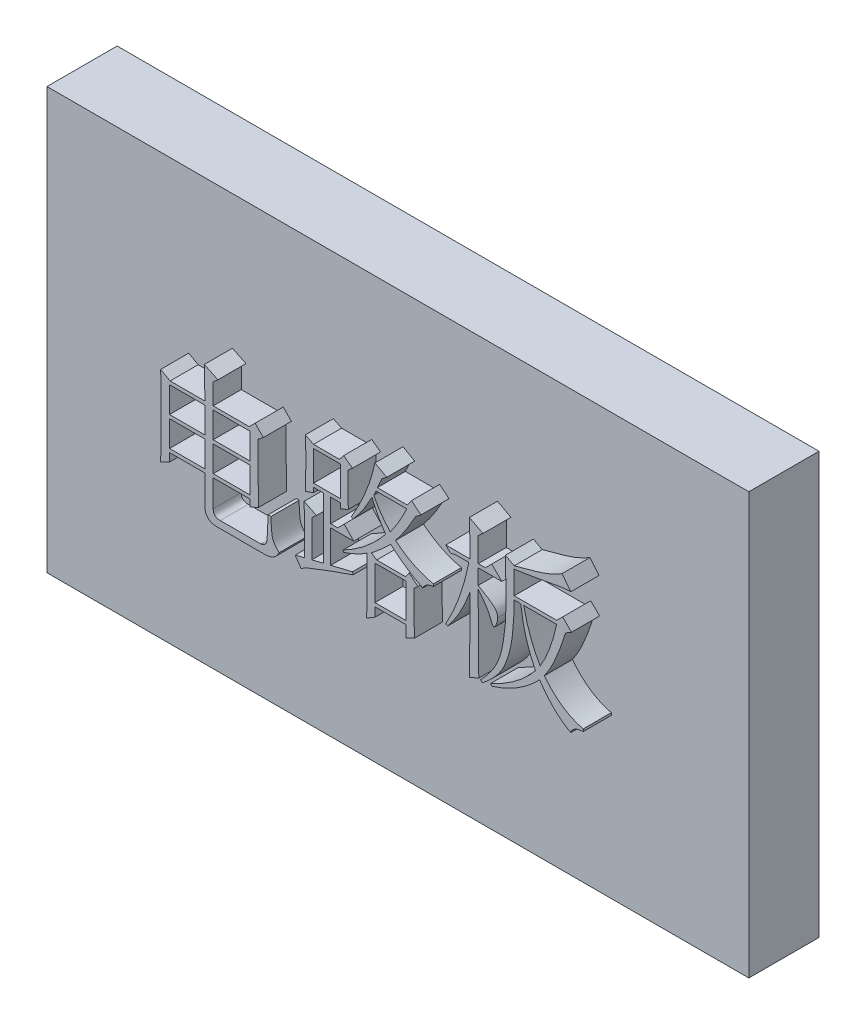
from build123d import *

# Parameters (mm, degrees)
SKETCH_1_W      = 25
SKETCH_1_H      = 15
EXTRUDE_1_DEPTH = 2.5
SKETCH_2_W      = 1.261471265
SKETCH_2_H      = 0.920406812
SKETCH_2_W_2    = 1.303520307
SKETCH_2_W_3    = 1.114299617
SKETCH_2_H_2    = 1.219422222
SKETCH_2_W_4    = 0.96712797
SKETCH_2_H_3    = 1.069914517
EXTRUDE_3_DEPTH = 1


with BuildPart() as part:
    # 草图1 → 凸台-拉伸1 (new body)
    with BuildSketch(Plane.XY):
        Rectangle(SKETCH_1_W, SKETCH_1_H)
    extrude(amount=EXTRUDE_1_DEPTH)

    # 草图2 → 凸台-拉伸3 (add)
    # profile 1 of 5: a face of its own
    with BuildSketch(Plane.XY.offset(2.5)):
        with BuildLine():
            add(Edge.make_bspline(
                [(-5.873960112, 1.610145071), (-5.874293191, 1.71007808), (-5.874944667, 1.905538999), (-5.879030599, 2.192102448), (-5.884704815, 2.465460886), (-5.891614746, 2.643209641), (-5.894984633, 2.72989549)],
                knots=[0, 0, 0, 0, 1.070688816, 2.094181113, 3.070555925, 4, 4, 4, 4], degree=3))
            Line((-5.894984633, 2.72989549), (-5.411420649, 2.497847072))
            Line((-5.411420649, 2.497847072), (-5.579616817, 2.349896738))
            Line((-5.579616817, 2.349896738), (-5.579616817, 1.610145071))
            Line((-5.579616817, 1.610145071), (-4.297121031, 1.610145071))
            Line((-4.297121031, 1.610145071), (-4.08687582, 1.820390281))
            Line((-4.08687582, 1.820390281), (-3.792532525, 1.526046986))
            Line((-3.792532525, 1.526046986), (-3.981753215, 1.379654025))
            add(Edge.make_bspline(
                [(-3.981753215, 1.379654025), (-3.981731731, 1.311389266), (-3.981689824, 1.178234053), (-3.981987073, 0.983561398), (-3.980943247, 0.7987543), (-3.980226075, 0.623809432), (-3.979459302, 0.458727802), (-3.978593576, 0.303510478), (-3.978121896, 0.157891394), (-3.976314109, 0.021884914), (-3.974814658, -0.104262642), (-3.97327917, -0.220287543), (-3.971628187, -0.326446437), (-3.970390741, -0.423016251), (-3.967854092, -0.509701436), (-3.96555129, -0.586532735), (-3.963260937, -0.653502519), (-3.961529551, -0.695025815), (-3.960728694, -0.714232538)],
                knots=[0, 0, 0, 0, 1.564731616, 3.052119083, 4.462174954, 5.800836896, 7.0621555, 8.246130873, 9.358712606, 10.399951826, 11.363852354, 12.25041514, 13.059641411, 13.79748155, 14.464070136, 15.047399153, 15.559371661, 16, 16, 16, 16], degree=3))
            Line((-3.960728694, -0.714232538), (-4.27609651, -0.861404186))
            Line((-4.27609651, -0.861404186), (-4.27609651, -0.609109933))
            Line((-4.27609651, -0.609109933), (-5.579616817, -0.609109933))
            Line((-5.579616817, -0.609109933), (-5.579616817, -1.567672357))
            add(Edge.make_bspline(
                [(-5.579616817, -1.567672357), (-5.578941822, -1.586152535), (-5.577671101, -1.620942644), (-5.566406628, -1.669817831), (-5.545200229, -1.710491068), (-5.517842815, -1.745437686), (-5.480787622, -1.771230159), (-5.436393384, -1.789323043), (-5.384401313, -1.799982446), (-5.347101545, -1.801338014), (-5.327322564, -1.802056833)],
                knots=[0, 0, 0, 0, 1.124103962, 2.116197056, 3.020287974, 3.895928428, 4.79003215, 5.731558757, 6.79711165, 8, 8, 8, 8], degree=3))
            Line((-5.327322564, -1.802056833), (-3.876630609, -1.802056833))
            add(Edge.make_bspline(
                [(-3.876630609, -1.802056833), (-3.861707878, -1.800003426), (-3.832839016, -1.796030996), (-3.793121644, -1.781467096), (-3.757682669, -1.76303101), (-3.728433092, -1.737460701), (-3.704798967, -1.706279624), (-3.685727652, -1.669822118), (-3.672828869, -1.627563441), (-3.665481071, -1.578770717), (-3.66054034, -1.521246414), (-3.654742189, -1.451974575), (-3.650791656, -1.36961154), (-3.644901007, -1.274652334), (-3.639707259, -1.167177927), (-3.633919113, -1.047023121), (-3.629815425, -0.913824864), (-3.626219519, -0.820650409), (-3.624336356, -0.7718553)],
                knots=[0, 0, 0, 0, 0.629422311, 1.217652751, 1.762775589, 2.294829829, 2.829987746, 3.394303386, 4.0100451, 4.671629752, 5.458421737, 6.429409418, 7.584151651, 8.913252979, 10.416123777, 12.092816459, 13.95382277, 16, 16, 16, 16], degree=3))
            Line((-3.624336356, -0.7718553), (-3.519213751, -0.7718553))
            add(Edge.make_bspline(
                [(-3.519213751, -0.7718553), (-3.519253568, -0.813910538), (-3.519329535, -0.894148352), (-3.514760154, -1.008863305), (-3.51025316, -1.112299591), (-3.501182999, -1.204411889), (-3.491628773, -1.28556703), (-3.479274074, -1.35577969), (-3.465179292, -1.415114465), (-3.442242632, -1.478436078), (-3.406765852, -1.546606592), (-3.355084501, -1.618889323), (-3.295267482, -1.684650681), (-3.248562901, -1.720697385), (-3.224870456, -1.738983269)],
                knots=[0, 0, 0, 0, 1.432623561, 2.73332378, 3.91109551, 4.959115756, 5.885964426, 6.694330385, 7.387096859, 7.960541899, 8.984902095, 9.993374407, 10.982072752, 12, 12, 12, 12], degree=3))
            add(Edge.make_bspline(
                [(-3.224870456, -1.738983269), (-3.239033072, -1.765319229), (-3.266385839, -1.816182809), (-3.316257265, -1.883703331), (-3.372191551, -1.939173319), (-3.434465615, -1.983581626), (-3.506808709, -2.016492311), (-3.59086943, -2.037890584), (-3.687445656, -2.052199201), (-3.75613395, -2.053605745), (-3.792532525, -2.054351086)],
                knots=[0, 0, 0, 0, 1.033786579, 1.996588944, 2.892065822, 3.749251075, 4.629327101, 5.624996779, 6.741463396, 8, 8, 8, 8], degree=3))
            Line((-3.792532525, -2.054351086), (-5.43244517, -2.054351086))
            add(Edge.make_bspline(
                [(-5.43244517, -2.054351086), (-5.467065469, -2.053044287), (-5.532249894, -2.050583797), (-5.623732976, -2.031460367), (-5.701774586, -1.99831545), (-5.765298874, -1.950063462), (-5.815267176, -1.888869649), (-5.850493015, -1.81387099), (-5.870309003, -1.725455141), (-5.872696082, -1.662516481), (-5.873960112, -1.629188548)],
                knots=[0, 0, 0, 0, 1.182522994, 2.2264996, 3.175847754, 4.055853476, 4.925921917, 5.850408872, 6.861726179, 8, 8, 8, 8], degree=3))
            Line((-5.873960112, -1.629188548), (-5.873960112, -0.609109933))
            Line((-5.873960112, -0.609109933), (-7.135431377, -0.609109933))
            Line((-7.135431377, -0.609109933), (-7.135431377, -0.903453228))
            Line((-7.135431377, -0.903453228), (-7.450799194, -1.050624875))
            add(Edge.make_bspline(
                [(-7.450799194, -1.050624875), (-7.444911768, -0.809244923), (-7.432986217, -0.320306431), (-7.428785836, 0.291826232), (-7.430878263, 0.780335001), (-7.434820694, 1.133864599), (-7.440536944, 1.471845939), (-7.447432366, 1.691913411), (-7.450799194, 1.79936576)],
                knots=[0, 0, 0, 0, 1.524726016, 3.088480342, 3.86542604, 4.609627723, 5.321122896, 6, 6, 6, 6], degree=3))
            Line((-7.450799194, 1.79936576), (-7.114406856, 1.610145071))
            Line((-7.114406856, 1.610145071), (-5.873960112, 1.610145071))
        make_face()
        with Locations((-6.504695745, 1.023794538)):
            Rectangle(SKETCH_2_W, SKETCH_2_H, mode=Mode.SUBTRACT)
        with Locations((-4.927856664, 1.023794538)):
            Rectangle(SKETCH_2_W_2, SKETCH_2_H, mode=Mode.SUBTRACT)
        with Locations((-6.504695745, -0.0227594)):
            Rectangle(SKETCH_2_W, SKETCH_2_H, mode=Mode.SUBTRACT)
        with Locations((-4.927856664, -0.0227594)):
            Rectangle(SKETCH_2_W_2, SKETCH_2_H, mode=Mode.SUBTRACT)
    # profile 2 of 5: a face of its own
    with BuildSketch(Plane.XY.offset(2.5)):
        with BuildLine():
            add(Edge.make_bspline(
                [(1.568720351, -0.443249822), (1.568570125, -0.516965985), (1.568275487, -0.661545011), (1.570391334, -0.874122292), (1.571620607, -1.078142476), (1.573908687, -1.273596714), (1.577382192, -1.460470938), (1.579864933, -1.639075426), (1.585026248, -1.809066965), (1.588201791, -1.919638222), (1.589744872, -1.973367745)],
                knots=[0, 0, 0, 0, 1.156075091, 2.267402447, 3.333953499, 4.355768899, 5.332869445, 6.265198951, 7.157013905, 8, 8, 8, 8], degree=3))
            Line((1.589744872, -1.973367745), (1.295401577, -2.119760707))
            Line((1.295401577, -2.119760707), (1.295401577, -1.705499773))
            Line((1.295401577, -1.705499773), (0.18110196, -1.705499773))
            Line((0.18110196, -1.705499773), (0.18110196, -2.030211821))
            Line((0.18110196, -2.030211821), (-0.113241336, -2.203858791))
            add(Edge.make_bspline(
                [(-0.113241336, -2.203858791), (-0.111677547, -2.144419465), (-0.108365712, -2.018537238), (-0.103258519, -1.819209415), (-0.100817069, -1.598559023), (-0.097352055, -1.357174421), (-0.095089802, -1.09475348), (-0.093860257, -0.811568131), (-0.091759637, -0.507104577), (-0.092061069, -0.297116823), (-0.092216815, -0.188619511)],
                knots=[0, 0, 0, 0, 0.708063395, 1.499555993, 2.37437348, 3.335728837, 4.374319062, 5.49943061, 6.707995802, 8, 8, 8, 8], degree=3))
            add(Edge.make_bspline(
                [(-0.092216815, -0.188619511), (-0.118014563, -0.206252865), (-0.171121922, -0.242552966), (-0.256602197, -0.294060425), (-0.350016826, -0.344452417), (-0.451549246, -0.39407211), (-0.560457039, -0.444007023), (-0.677578425, -0.493085489), (-0.802579661, -0.54111291), (-0.88899861, -0.571675475), (-0.933197658, -0.587306726)],
                knots=[0, 0, 0, 0, 0.803181656, 1.65343328, 2.564064877, 3.530923237, 4.558069038, 5.643652808, 6.794844159, 8, 8, 8, 8], degree=3))
            Line((-0.933197658, -0.587306726), (-0.954222179, -0.524233162))
            add(Edge.make_bspline(
                [(-0.954222179, -0.524233162), (-0.882913931, -0.486350833), (-0.740469037, -0.410677337), (-0.534894098, -0.282969719), (-0.33562049, -0.144624242), (-0.142646635, 0.004398734), (0.042958553, 0.16587986), (0.223159589, 0.336977757), (0.396368227, 0.519928846), (0.504907357, 0.649455575), (0.559543339, 0.71465621)],
                knots=[0, 0, 0, 0, 0.983426103, 1.964485598, 2.945998498, 3.937716184, 4.933016487, 5.941692797, 6.963897756, 8, 8, 8, 8], degree=3))
            add(Edge.make_bspline(
                [(0.559543339, 0.71465621), (0.51463944, 0.782697973), (0.423298193, 0.921105096), (0.298955673, 1.140925825), (0.181360808, 1.373356091), (0.111487205, 1.535006789), (0.075979354, 1.617153244)],
                knots=[0, 0, 0, 0, 0.953642408, 1.939851275, 2.953088865, 4, 4, 4, 4], degree=3))
            add(Edge.make_bspline(
                [(0.075979354, 1.617153244), (0.049799229, 1.56741511), (-0.001830505, 1.469326707), (-0.08322584, 1.327149053), (-0.164220887, 1.190697557), (-0.248388217, 1.061891082), (-0.332584268, 0.93880802), (-0.41951029, 0.822989679), (-0.5061018, 0.712617441), (-0.566894148, 0.643527416), (-0.596805321, 0.609533604)],
                knots=[0, 0, 0, 0, 1.110413406, 2.189842468, 3.236429234, 4.244932439, 5.229299372, 6.182130003, 7.105567974, 8, 8, 8, 8], degree=3))
            Line((-0.596805321, 0.609533604), (-0.659878884, 0.651582646))
            add(Edge.make_bspline(
                [(-0.659878884, 0.651582646), (-0.610412244, 0.735561918), (-0.512205584, 0.902286882), (-0.377588063, 1.157517518), (-0.254563144, 1.414458777), (-0.142696128, 1.673185385), (-0.043836509, 1.934451624), (0.043237162, 2.197667995), (0.11953147, 2.462506476), (0.160614833, 2.640923769), (0.18110196, 2.72989549)],
                knots=[0, 0, 0, 0, 1.038482929, 2.061711474, 3.0736857, 4.073525645, 5.064454001, 6.049318829, 7.027249784, 8, 8, 8, 8], degree=3))
            Line((0.18110196, 2.72989549), (0.601592381, 2.4962897))
            Line((0.601592381, 2.4962897), (0.433396213, 2.369363887))
            add(Edge.make_bspline(
                [(0.433396213, 2.369363887), (0.429509715, 2.361314085), (0.420727394, 2.343123939), (0.406014852, 2.313100796), (0.38872493, 2.277094099), (0.369439937, 2.23483825), (0.346857234, 2.186940861), (0.321788019, 2.133020297), (0.294696362, 2.072868347), (0.275355712, 2.030880089), (0.265200044, 2.008832285)],
                knots=[0, 0, 0, 0, 0.539231941, 1.218502942, 2.016901858, 2.94864505, 4.020381651, 5.211308116, 6.535673232, 8, 8, 8, 8], degree=3))
            Line((0.265200044, 2.008832285), (1.337450619, 2.008832285))
            Line((1.337450619, 2.008832285), (1.484622267, 2.219077496))
            Line((1.484622267, 2.219077496), (1.821014604, 1.945758722))
            Line((1.821014604, 1.945758722), (1.631793914, 1.79936576))
            add(Edge.make_bspline(
                [(1.631793914, 1.79936576), (1.578451396, 1.702798061), (1.472271363, 1.510576886), (1.297759501, 1.233139182), (1.11456075, 0.964777482), (0.98270306, 0.794235736), (0.916960197, 0.709205408)],
                knots=[0, 0, 0, 0, 1.014059853, 2.01851942, 3.012054537, 4, 4, 4, 4], degree=3))
            add(Edge.make_bspline(
                [(0.916960197, 0.709205408), (0.966229279, 0.66823604), (1.064357922, 0.586637839), (1.220804381, 0.478001536), (1.380611681, 0.376997708), (1.546859261, 0.288817072), (1.717960977, 0.209468703), (1.894414253, 0.141473126), (2.075927826, 0.082685485), (2.200002891, 0.053476453), (2.262529547, 0.038756791)],
                knots=[0, 0, 0, 0, 1.012200449, 2.015987588, 3.007360368, 3.998359673, 4.987634074, 5.986312249, 6.985217858, 8, 8, 8, 8], degree=3))
            Line((2.262529547, 0.038756791), (2.262529547, -0.045341293))
            add(Edge.make_bspline(
                [(2.262529547, -0.045341293), (2.240656868, -0.047755023), (2.198116509, -0.052449507), (2.137290376, -0.066586842), (2.081352262, -0.08578883), (2.030927345, -0.111654447), (1.985926862, -0.144101018), (1.946187189, -0.182431365), (1.911296411, -0.226318513), (1.893234515, -0.259187727), (1.884088167, -0.275832339)],
                knots=[0, 0, 0, 0, 1.134734259, 2.206954362, 3.215187527, 4.179676073, 5.120148686, 6.067463956, 7.021384751, 8, 8, 8, 8], degree=3))
            add(Edge.make_bspline(
                [(1.884088167, -0.275832339), (1.833515341, -0.250813327), (1.732115002, -0.200649308), (1.583819741, -0.11776478), (1.437662042, -0.0297598), (1.294624227, 0.064764493), (1.15334937, 0.164071181), (1.015776781, 0.270560879), (0.879731466, 0.38138109), (0.792558287, 0.460161169), (0.748764029, 0.499738883)],
                knots=[0, 0, 0, 0, 0.981251834, 1.967445259, 2.953855669, 3.948076765, 4.948918038, 5.956659647, 6.973462052, 8, 8, 8, 8], degree=3))
            add(Edge.make_bspline(
                [(0.748764029, 0.499738883), (0.726765974, 0.478128726), (0.681322034, 0.433486111), (0.609557463, 0.365569959), (0.531357983, 0.294796285), (0.447807307, 0.220221996), (0.357688927, 0.142953745), (0.261915048, 0.0622732), (0.161147098, -0.022963207), (0.090896957, -0.079492658), (0.054954833, -0.108414856)],
                knots=[0, 0, 0, 0, 0.801819482, 1.65641172, 2.568950904, 3.544202781, 4.568346245, 5.655468497, 6.800465862, 8, 8, 8, 8], degree=3))
            Line((0.054954833, -0.108414856), (0.244175523, -0.233783297))
            Line((0.244175523, -0.233783297), (1.274377056, -0.233783297))
            Line((1.274377056, -0.233783297), (1.400524182, -0.065587128))
            Line((1.400524182, -0.065587128), (1.715891999, -0.317881381))
            Line((1.715891999, -0.317881381), (1.568720351, -0.443249822))
        make_face()
        with BuildLine():
            add(Edge.make_bspline(
                [(0.139052917, 1.71448899), (0.176500421, 1.641117665), (0.252233452, 1.492733068), (0.390498334, 1.279727347), (0.54821328, 1.07119618), (0.667253699, 0.940113014), (0.727739508, 0.873508147)],
                knots=[0, 0, 0, 0, 0.958724281, 1.938903467, 2.952733094, 4, 4, 4, 4], degree=3))
            add(Edge.make_bspline(
                [(0.727739508, 0.873508147), (0.78021955, 0.946662594), (0.887962519, 1.096850682), (1.037896517, 1.339258464), (1.181823144, 1.602735695), (1.270796709, 1.787784396), (1.316426098, 1.882685159)],
                knots=[0, 0, 0, 0, 0.922965254, 1.894873015, 2.920402286, 4, 4, 4, 4], degree=3))
            Line((1.316426098, 1.882685159), (0.223151002, 1.882685159))
            Line((0.223151002, 1.882685159), (0.139052917, 1.71448899))
        make_face(mode=Mode.SUBTRACT)
        with Locations((0.738251769, -0.969641535)):
            Rectangle(SKETCH_2_W_3, SKETCH_2_H_2, mode=Mode.SUBTRACT)
    # profile 3 of 5: a face of its own
    with BuildSketch(Plane.XY.offset(2.5)):
        with BuildLine():
            Line((-2.068521796, -1.385459841), (-1.648031375, -1.280337235))
            Line((-1.648031375, -1.280337235), (-1.648031375, 0.885967122))
            Line((-1.648031375, 0.885967122), (-2.005448233, 0.885967122))
            Line((-2.005448233, 0.885967122), (-2.005448233, 0.717770953))
            Line((-2.005448233, 0.717770953), (-2.299791528, 0.612648348))
            add(Edge.make_bspline(
                [(-2.299791528, 0.612648348), (-2.296455316, 0.6951816), (-2.289868052, 0.85814134), (-2.283943242, 1.099825355), (-2.280016121, 1.335514479), (-2.278176294, 1.563942565), (-2.279861553, 1.781992977), (-2.283737437, 1.986538294), (-2.289373345, 2.176083678), (-2.296413229, 2.297217744), (-2.299791528, 2.35534754)],
                knots=[0, 0, 0, 0, 1.137088609, 2.245151607, 3.327980768, 4.382101098, 5.389770851, 6.329694142, 7.198453894, 8, 8, 8, 8], degree=3))
            Line((-2.299791528, 2.35534754), (-2.005448233, 2.208175892))
            Line((-2.005448233, 2.208175892), (-1.080369305, 2.208175892))
            Line((-1.080369305, 2.208175892), (-0.933197658, 2.397396582))
            Line((-0.933197658, 2.397396582), (-0.617829842, 2.166905536))
            Line((-0.617829842, 2.166905536), (-0.78602601, 2.022069947))
            add(Edge.make_bspline(
                [(-0.78602601, 2.022069947), (-0.786186708, 1.950949324), (-0.786494031, 1.814935545), (-0.784407427, 1.620008413), (-0.783165519, 1.44324178), (-0.78096232, 1.284381758), (-0.777477941, 1.143453757), (-0.77507351, 1.020377988), (-0.770120952, 0.91553369), (-0.766593539, 0.851702775), (-0.765001489, 0.822893559)],
                knots=[0, 0, 0, 0, 1.422980224, 2.72136139, 3.900299521, 4.959859205, 5.900086603, 6.720900155, 7.422695657, 8, 8, 8, 8], degree=3))
            Line((-0.765001489, 0.822893559), (-1.038320263, 0.696746432))
            Line((-1.038320263, 0.696746432), (-1.038320263, 0.885967122))
            Line((-1.038320263, 0.885967122), (-1.395737122, 0.885967122))
            Line((-1.395737122, 0.885967122), (-1.395737122, 0.065232114))
            Line((-1.395737122, 0.065232114), (-1.143442869, 0.065232114))
            Line((-1.143442869, 0.065232114), (-0.912173137, 0.296501846))
            Line((-0.912173137, 0.296501846), (-0.575780799, -0.060915013))
            Line((-0.575780799, -0.060915013), (-1.395737122, -0.060915013))
            Line((-1.395737122, -0.060915013), (-1.395737122, -1.217263672))
            Line((-1.395737122, -1.217263672), (-0.617829842, -1.028042982))
            Line((-0.617829842, -1.028042982), (-0.596805321, -1.112141067))
            add(Edge.make_bspline(
                [(-0.596805321, -1.112141067), (-0.660933531, -1.133895181), (-0.791136589, -1.178063765), (-0.989450101, -1.246368473), (-1.193080039, -1.320141133), (-1.403507291, -1.39577726), (-1.619172182, -1.477308668), (-1.840943702, -1.561917698), (-2.068517821, -1.650863349), (-2.221954633, -1.711908918), (-2.299791528, -1.742876699)],
                knots=[0, 0, 0, 0, 0.894805206, 1.816772587, 2.771460411, 3.756614308, 4.771418497, 5.817957484, 6.893072574, 8, 8, 8, 8], degree=3))
            Line((-2.299791528, -1.742876699), (-2.446963176, -1.847999305))
            Line((-2.446963176, -1.847999305), (-2.657208387, -1.532631488))
            Line((-2.657208387, -1.532631488), (-2.320816049, -1.448533404))
            add(Edge.make_bspline(
                [(-2.320816049, -1.448533404), (-2.320837067, -1.396101938), (-2.320878165, -1.293575062), (-2.320584496, -1.143027625), (-2.321630444, -0.998972072), (-2.322344588, -0.861404086), (-2.323117954, -0.730325082), (-2.323973428, -0.605995719), (-2.324461542, -0.487889309), (-2.326256435, -0.376541994), (-2.327780396, -0.271419238), (-2.329302916, -0.173044318), (-2.330958415, -0.080902117), (-2.332187091, 0.004508168), (-2.334784786, 0.083403333), (-2.337059426, 0.155822746), (-2.339359873, 0.221753467), (-2.341045028, 0.263538125), (-2.34184057, 0.283264184)],
                knots=[0, 0, 0, 0, 1.453041629, 2.841343779, 4.172119168, 5.445349232, 6.653840905, 7.804787447, 8.890995849, 9.926927407, 10.890933666, 11.804592913, 12.653521321, 13.44491239, 14.171753626, 14.841076208, 15.452885318, 16, 16, 16, 16], degree=3))
            Line((-2.34184057, 0.283264184), (-1.900325628, 0.068346858))
            Line((-1.900325628, 0.068346858), (-2.068521796, -0.081939534))
            Line((-2.068521796, -0.081939534), (-2.068521796, -1.385459841))
        make_face()
        with Locations((-1.521884248, 1.547071508)):
            Rectangle(SKETCH_2_W_4, SKETCH_2_H_3, mode=Mode.SUBTRACT)
    # profile 4 of 5: a face of its own
    with BuildSketch(Plane.XY.offset(2.5)):
        with BuildLine():
            add(Edge.make_bspline(
                [(6.972022269, 0.881295006), (6.942366083, 0.787964154), (6.884891213, 0.607085242), (6.793972024, 0.346717455), (6.701077581, 0.105913822), (6.608281718, -0.116674247), (6.512578962, -0.319686081), (6.416079132, -0.504101118), (6.318944789, -0.66979217), (6.248722679, -0.770441644), (6.21513951, -0.818576458)],
                knots=[0, 0, 0, 0, 1.257941982, 2.437941705, 3.541995365, 4.573063656, 5.535105204, 6.424001252, 7.246291075, 8, 8, 8, 8], degree=3))
            add(Edge.make_bspline(
                [(6.21513951, -0.818576458), (6.264344384, -0.87930806), (6.361061974, -0.998682702), (6.518732766, -1.161328), (6.682924544, -1.306528956), (6.853861437, -1.433350913), (7.030272149, -1.544870667), (7.215079769, -1.635293035), (7.40534389, -1.710978585), (7.536932938, -1.745735858), (7.602757902, -1.763122534)],
                knots=[0, 0, 0, 0, 1.095466608, 2.153260081, 3.171760661, 4.165280718, 5.134693411, 6.093307648, 7.046212746, 8, 8, 8, 8], degree=3))
            Line((7.602757902, -1.763122534), (7.602757902, -1.847220619))
            add(Edge.make_bspline(
                [(7.602757902, -1.847220619), (7.572853795, -1.849562275), (7.515837874, -1.854026934), (7.435272005, -1.868398956), (7.364676566, -1.890150381), (7.30350903, -1.917796065), (7.25278874, -1.953461174), (7.21143002, -1.995066469), (7.179778561, -2.043861604), (7.167494401, -2.080228815), (7.161242959, -2.098736186)],
                knots=[0, 0, 0, 0, 1.321355975, 2.519330509, 3.597404447, 4.569621419, 5.464482174, 6.31373748, 7.14185654, 8, 8, 8, 8], degree=3))
            add(Edge.make_bspline(
                [(7.161242959, -2.098736186), (7.111923606, -2.072624719), (7.011479682, -2.019446035), (6.867660115, -1.921222776), (6.72492022, -1.809882456), (6.584397362, -1.683168137), (6.446765572, -1.540758848), (6.31031764, -1.383774376), (6.175469114, -1.211852973), (6.090448393, -1.089231132), (6.046943342, -1.02648561)],
                knots=[0, 0, 0, 0, 0.856344774, 1.744034038, 2.66971892, 3.634941658, 4.646841014, 5.709085365, 6.827740381, 8, 8, 8, 8], degree=3))
            add(Edge.make_bspline(
                [(6.046943342, -1.02648561), (5.988322352, -1.086521167), (5.871457703, -1.206205842), (5.682009405, -1.370009949), (5.483909474, -1.521817079), (5.275486146, -1.659931521), (5.056884875, -1.78433178), (4.829235734, -1.897025741), (4.591044402, -1.995538787), (4.426852192, -2.050143569), (4.343957134, -2.077711665)],
                knots=[0, 0, 0, 0, 0.994790829, 1.983178384, 2.967082931, 3.953229128, 4.94599354, 5.948258306, 6.964145451, 8, 8, 8, 8], degree=3))
            Line((4.343957134, -2.077711665), (4.301908092, -2.014638101))
            add(Edge.make_bspline(
                [(4.301908092, -2.014638101), (4.384354672, -1.975510031), (4.546578543, -1.8985207), (4.779457956, -1.770008618), (4.999229738, -1.633188974), (5.205736623, -1.487359377), (5.399608513, -1.33393745), (5.579959824, -1.171284879), (5.748018746, -1.000803238), (5.849451954, -0.879001011), (5.899771694, -0.818576458)],
                knots=[0, 0, 0, 0, 1.087294989, 2.139387739, 3.167566167, 4.170755333, 5.150394089, 6.111856039, 7.063315513, 8, 8, 8, 8], degree=3))
            add(Edge.make_bspline(
                [(5.899771694, -0.818576458), (5.867135762, -0.752978967), (5.801229996, -0.62050986), (5.714722268, -0.414116829), (5.636737326, -0.199846464), (5.566806929, 0.021757759), (5.50507945, 0.251390898), (5.452469503, 0.488912232), (5.407645527, 0.734342909), (5.385413805, 0.901176799), (5.374158667, 0.985638926)],
                knots=[0, 0, 0, 0, 0.930735249, 1.879548537, 2.841493965, 3.827168227, 4.831166319, 5.861744168, 6.917476321, 8, 8, 8, 8], degree=3))
            Line((5.374158667, 0.985638926), (5.142888935, 0.985638926))
            add(Edge.make_bspline(
                [(5.142888935, 0.985638926), (5.142090817, 0.896858447), (5.140470587, 0.716628412), (5.128585209, 0.44212885), (5.107537968, 0.160000181), (5.082041377, -0.127060062), (5.04363652, -0.411612607), (4.984112167, -0.686503397), (4.906111216, -0.948013976), (4.826893178, -1.157870308), (4.748820418, -1.319395855), (4.678510221, -1.439570396), (4.595691628, -1.558350451), (4.501283823, -1.676708872), (4.395730962, -1.794736553), (4.277511094, -1.911797161), (4.147278381, -2.027595277), (4.054850796, -2.102476141), (4.007564797, -2.140785228)],
                knots=[0, 0, 0, 0, 1.227325534, 2.491549106, 3.797434423, 5.138172562, 6.475333417, 7.76400838, 9.021937379, 10.245396153, 10.860041659, 11.500085974, 12.167979968, 12.860073136, 13.591943094, 14.355675379, 15.158762703, 16, 16, 16, 16], degree=3))
            Line((4.007564797, -2.140785228), (3.944491233, -2.077711665))
            add(Edge.make_bspline(
                [(3.944491233, -2.077711665), (3.993477065, -2.027220773), (4.089965818, -1.927767463), (4.220230696, -1.769932208), (4.33763164, -1.610450405), (4.440473476, -1.447845426), (4.527719816, -1.281868223), (4.600471533, -1.112864536), (4.65945402, -0.94111522), (4.71716963, -0.707561648), (4.768711899, -0.410854757), (4.815299974, -0.051006772), (4.842650431, 0.314232068), (4.852381373, 0.810412716), (4.844079229, 1.441246742), (4.833080199, 1.948624543), (4.827521119, 2.205061149)],
                knots=[0, 0, 0, 0, 0.653883181, 1.287971847, 1.901029547, 2.494290377, 3.075088731, 3.642658876, 4.203622543, 4.761462489, 5.877700866, 7.001767737, 8.134414056, 9.281166039, 11.615028173, 14, 14, 14, 14], degree=3))
            Line((4.827521119, 2.205061149), (5.142888935, 2.03686498))
            add(Edge.make_bspline(
                [(5.142888935, 2.03686498), (5.219761588, 2.056952992), (5.366389745, 2.095269196), (5.57493534, 2.152395275), (5.76202221, 2.204141299), (5.926751409, 2.252509654), (6.069744246, 2.295706886), (6.190293901, 2.335655852), (6.289452296, 2.36970016), (6.390678801, 2.411537104), (6.499525808, 2.461346272), (6.621034091, 2.521600383), (6.736595438, 2.581683606), (6.809964946, 2.624729091), (6.845875143, 2.645797405)],
                knots=[0, 0, 0, 0, 1.575185515, 3.00453465, 4.286774431, 5.423402618, 6.40820872, 7.247890787, 7.941233698, 8.485922522, 9.418595944, 10.31382105, 11.174711414, 12, 12, 12, 12], degree=3))
            Line((6.845875143, 2.645797405), (7.161242959, 2.246331505))
            add(Edge.make_bspline(
                [(7.161242959, 2.246331505), (7.116044667, 2.245082992), (7.019452127, 2.242414816), (6.865580955, 2.225676029), (6.693414631, 2.198969891), (6.572988384, 2.174917309), (6.509482806, 2.16223342)],
                knots=[0, 0, 0, 0, 0.824119463, 1.761212367, 2.819397703, 4, 4, 4, 4], degree=3))
            add(Edge.make_bspline(
                [(6.509482806, 2.16223342), (6.471591089, 2.154943763), (6.390656618, 2.139373484), (6.26097574, 2.114923982), (6.114716701, 2.089651939), (5.951980409, 2.061570187), (5.772946119, 2.031072232), (5.577482409, 1.999205596), (5.365605429, 1.96592598), (5.218940755, 1.942902391), (5.142888935, 1.930963689)],
                knots=[0, 0, 0, 0, 0.66811574, 1.427055813, 2.284889375, 3.238016455, 4.286444973, 5.429447753, 6.667060248, 8, 8, 8, 8], degree=3))
            Line((5.142888935, 1.930963689), (5.142888935, 1.111786052))
            Line((5.142888935, 1.111786052), (6.656654453, 1.111786052))
            Line((6.656654453, 1.111786052), (6.866899664, 1.322031263))
            Line((6.866899664, 1.322031263), (7.18226748, 1.006663447))
            Line((7.18226748, 1.006663447), (6.972022269, 0.881295006))
        make_face()
        with BuildLine():
            add(Edge.make_bspline(
                [(5.479281272, 0.985638926), (5.495612044, 0.911276003), (5.527839135, 0.764528456), (5.584984631, 0.549184293), (5.648622765, 0.341022881), (5.719744185, 0.140487755), (5.795766979, -0.053391651), (5.879283126, -0.239636165), (5.96927987, -0.419034428), (6.035251999, -0.534125832), (6.067967863, -0.591200155)],
                knots=[0, 0, 0, 0, 1.080669623, 2.132589899, 3.161729263, 4.169756105, 5.152295409, 6.117140908, 7.066282052, 8, 8, 8, 8], degree=3))
            add(Edge.make_bspline(
                [(6.067967863, -0.591200155), (6.099080752, -0.53721967), (6.162311116, -0.427515755), (6.249579993, -0.255155943), (6.330143272, -0.072311273), (6.406736336, 0.119996103), (6.47698164, 0.322659722), (6.543713461, 0.534537845), (6.603253041, 0.7566243), (6.638654551, 0.908445446), (6.656654453, 0.985638926)],
                knots=[0, 0, 0, 0, 0.8845881, 1.797738118, 2.741516916, 3.720901658, 4.73616224, 5.786461557, 6.874526115, 8, 8, 8, 8], degree=3))
            Line((6.656654453, 0.985638926), (5.479281272, 0.985638926))
        make_face(mode=Mode.SUBTRACT)
    # profile 5 of 5: a face of its own
    with BuildSketch(Plane.XY.offset(2.5)):
        with BuildLine():
            add(Edge.make_bspline(
                [(3.860393149, 0.664820308), (3.860414777, 0.572156711), (3.860456942, 0.391501631), (3.860158497, 0.127785788), (3.861200075, -0.121652523), (3.861918474, -0.356556183), (3.862685705, -0.577184034), (3.863550461, -0.783275674), (3.864014512, -0.974836178), (3.865832686, -1.152113883), (3.867323466, -1.31511921), (3.868854376, -1.463848893), (3.87051123, -1.598040721), (3.871720257, -1.717709862), (3.874286544, -1.823084641), (3.876543827, -1.913933377), (3.878814058, -1.990508066), (3.880610277, -2.036701885), (3.88141767, -2.057465829)],
                knots=[0, 0, 0, 0, 1.633756874, 3.185139452, 4.649578535, 6.031643748, 7.326758823, 8.539500151, 9.665291501, 10.704163222, 11.665240261, 12.539370989, 13.326556364, 14.031373662, 14.649333409, 15.184942319, 15.633634688, 16, 16, 16, 16], degree=3))
            Line((3.88141767, -2.057465829), (3.545025333, -2.203858791))
            add(Edge.make_bspline(
                [(3.545025333, -2.203858791), (3.54658119, -2.1213182), (3.549839632, -1.94845282), (3.554978516, -1.677482625), (3.557423513, -1.383122659), (3.56091009, -1.065165506), (3.563163541, -0.723579072), (3.564398989, -0.358372904), (3.566502918, 0.03018929), (3.566203785, 0.297020659), (3.566049854, 0.434329262)],
                knots=[0, 0, 0, 0, 0.75098197, 1.57278717, 2.465354969, 3.428753842, 4.465326528, 5.572719828, 6.750947272, 8, 8, 8, 8], degree=3))
            add(Edge.make_bspline(
                [(3.566049854, 0.434329262), (3.540911083, 0.365588618), (3.491116145, 0.229426982), (3.407350331, 0.030843633), (3.317992405, -0.161117302), (3.221580123, -0.34574637), (3.117703895, -0.522696871), (3.007722444, -0.692532491), (2.892333326, -0.856005817), (2.808715772, -0.958930603), (2.767118053, -1.010133205)],
                knots=[0, 0, 0, 0, 1.058471934, 2.096623779, 3.116056311, 4.120194816, 5.107868541, 6.082521562, 7.046100646, 8, 8, 8, 8], degree=3))
            Line((2.767118053, -1.010133205), (2.70404449, -0.968862849))
            add(Edge.make_bspline(
                [(2.70404449, -0.968862849), (2.750540246, -0.88388751), (2.844022127, -0.713040637), (2.970343593, -0.447259094), (3.088270845, -0.173158656), (3.195691432, 0.110604505), (3.292682987, 0.403577057), (3.380854137, 0.705273825), (3.459183056, 1.016131923), (3.502243553, 1.227627476), (3.524000812, 1.334490239)],
                knots=[0, 0, 0, 0, 0.946605112, 1.903193631, 2.874922639, 3.862534623, 4.867784247, 5.890606494, 6.93418271, 8, 8, 8, 8], degree=3))
            Line((3.524000812, 1.334490239), (3.040436827, 1.334490239))
            Line((3.040436827, 1.334490239), (2.872240658, 1.292441196))
            Line((2.872240658, 1.292441196), (2.70404449, 1.460637365))
            Line((2.70404449, 1.460637365), (3.566049854, 1.460637365))
            add(Edge.make_bspline(
                [(3.566049854, 1.460637365), (3.566199564, 1.522673339), (3.566493351, 1.644411461), (3.564387118, 1.822985471), (3.563149188, 1.993782478), (3.560880333, 2.156273624), (3.557378883, 2.310959373), (3.554941954, 2.457644722), (3.549746001, 2.596483146), (3.546568312, 2.686288848), (3.545025333, 2.72989549)],
                knots=[0, 0, 0, 0, 1.172768499, 2.301416835, 3.376090522, 4.401755233, 5.373535746, 6.301162866, 7.175101584, 8, 8, 8, 8], degree=3))
            Line((3.545025333, 2.72989549), (4.028589318, 2.476043865))
            Line((4.028589318, 2.476043865), (3.860393149, 2.328093531))
            Line((3.860393149, 2.328093531), (3.860393149, 1.460637365))
            Line((3.860393149, 1.460637365), (4.112687402, 1.460637365))
            Line((4.112687402, 1.460637365), (4.343957134, 1.691907097))
            Line((4.343957134, 1.691907097), (4.701373992, 1.334490239))
            Line((4.701373992, 1.334490239), (3.860393149, 1.334490239))
            Line((3.860393149, 1.334490239), (3.860393149, 0.790188748))
            add(Edge.make_bspline(
                [(3.860393149, 0.790188748), (3.898846947, 0.768195035), (3.971845674, 0.726443292), (4.075320356, 0.665855948), (4.166297239, 0.608610439), (4.246411252, 0.557414329), (4.313816229, 0.5093113), (4.369950345, 0.466841069), (4.414844405, 0.429284559), (4.45700427, 0.385128446), (4.495120013, 0.332231403), (4.528776425, 0.268991639), (4.550783547, 0.205281722), (4.553079649, 0.161951351), (4.554202345, 0.140764653)],
                knots=[0, 0, 0, 0, 1.609576836, 3.055538459, 4.356101317, 5.514901716, 6.509259616, 7.363724174, 8.072604869, 8.632925068, 9.577984311, 10.430103654, 11.232387803, 12, 12, 12, 12], degree=3))
            add(Edge.make_bspline(
                [(4.554202345, 0.140764653), (4.55364094, 0.122804643), (4.552485247, 0.085832642), (4.5412674, 0.029364233), (4.525299077, -0.029997772), (4.502365006, -0.087892372), (4.479755047, -0.140161182), (4.459604916, -0.178822735), (4.445308229, -0.205835976), (4.432433223, -0.21274537), (4.428055218, -0.215094834)],
                knots=[0, 0, 0, 0, 1.117199074, 2.299836361, 3.57434675, 4.940289391, 6.177771153, 7.103089487, 7.695015376, 8, 8, 8, 8], degree=3))
            add(Edge.make_bspline(
                [(4.428055218, -0.215094834), (4.422710522, -0.214468878), (4.41111507, -0.21311085), (4.395358472, -0.201112291), (4.378981112, -0.185007092), (4.363483603, -0.161426265), (4.348197114, -0.131838782), (4.332787513, -0.095494333), (4.316268816, -0.05312036), (4.306876026, -0.022057661), (4.301908092, -0.005628309)],
                knots=[0, 0, 0, 0, 0.498607197, 1.081740723, 1.807756687, 2.668944288, 3.718709885, 4.944926498, 6.384143089, 8, 8, 8, 8], degree=3))
            add(Edge.make_bspline(
                [(4.301908092, -0.005628309), (4.290825842, 0.021000851), (4.268232716, 0.075289098), (4.227100836, 0.155624901), (4.180287238, 0.237286533), (4.127902246, 0.320547652), (4.070613161, 0.405878837), (4.005338322, 0.491035187), (3.935693502, 0.578406978), (3.885791301, 0.635673846), (3.860393149, 0.664820308)],
                knots=[0, 0, 0, 0, 0.857971833, 1.749127178, 2.683162688, 3.65822498, 4.675768006, 5.740073974, 6.849791322, 8, 8, 8, 8], degree=3))
        make_face()
    extrude(amount=EXTRUDE_3_DEPTH)


solid = part.part
